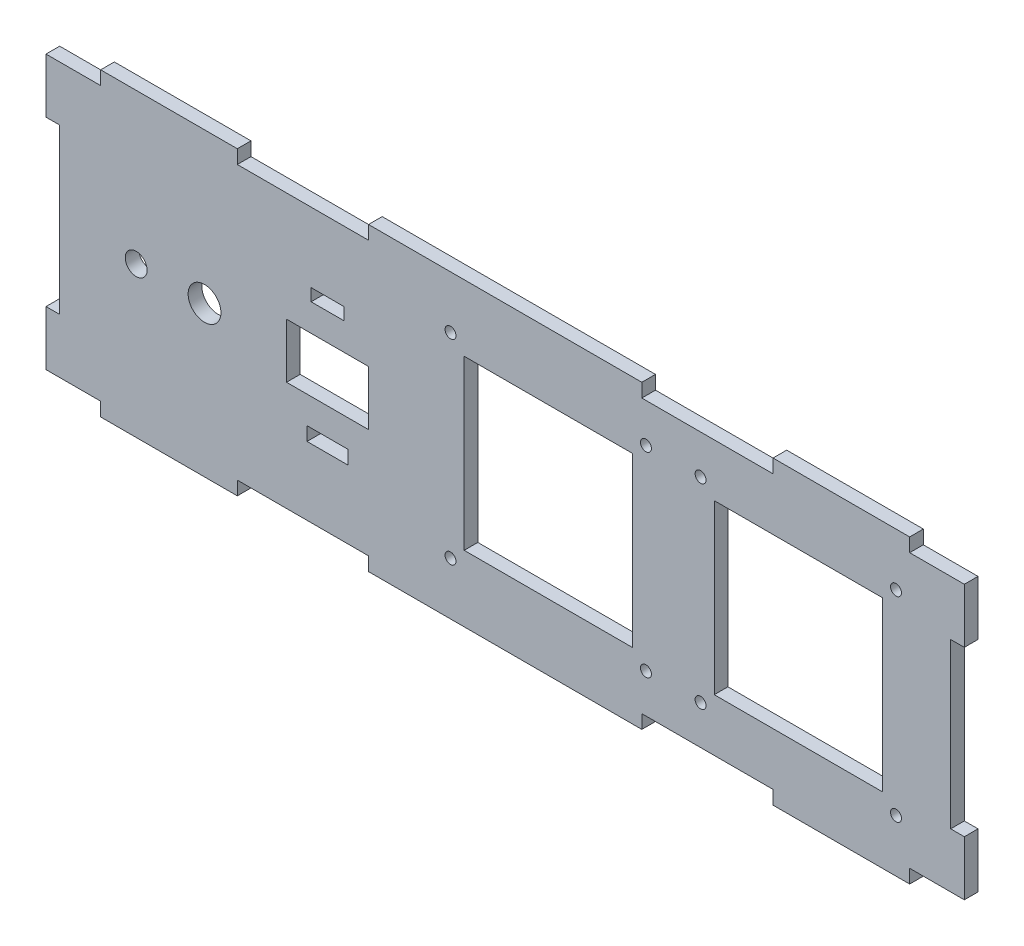
from build123d import *

# Parameters (mm, degrees)
SKETCH1_R           = 2
SKETCH1_W           = 15
SKETCH1_H           = 5
SKETCH1_W_2         = 61.5
SKETCH1_H_2         = 61.5
SKETCH1_R_2         = 4
SKETCH1_R_3         = 6
SKETCH1_W_3         = 30
SKETCH1_H_3         = 20
SKETCH1_W_4         = 12
SKETCH1_H_4         = 4.5
BOSS_EXTRUDE1_DEPTH = 5


with BuildPart() as part:
    # Sketch1 → Boss-Extrude1 (new body)
    with BuildSketch(Plane.XY):
        Polygon((148, -50), (168, -50), (168, -30), (163, -30), (163, 30), (168, 30), (168, 50), (148, 50), (148, 55), (98, 55), (98, 50), (50, 50), (50, 55), (-50, 55), (-50, 50), (-98, 50), (-98, 55), (-148, 55), (-148, 50), (-168, 50), (-168, 30), (-163, 30), (-163, -30), (-168, -30), (-168, -50), (-148, -50), (-148, -55), (-98, -55), (-98, -50), (-50, -50), (-50, -55), (50, -55), (50, -50), (98, -50), (98, -55), (148, -55), align=None)
        with Locations((-20, -35.75)):
            Circle(SKETCH1_R, mode=Mode.SUBTRACT)
        with Locations((-65, -22.5)):
            Rectangle(SKETCH1_W, SKETCH1_H, mode=Mode.SUBTRACT)
        with Locations((51.5, -35.75)):
            Circle(SKETCH1_R, mode=Mode.SUBTRACT)
        with Locations((71.5, -35.75)):
            Circle(SKETCH1_R, mode=Mode.SUBTRACT)
        with Locations((143, -35.75)):
            Circle(SKETCH1_R, mode=Mode.SUBTRACT)
        with Locations((15.75, 0)):
            Rectangle(SKETCH1_W_2, SKETCH1_H_2, mode=Mode.SUBTRACT)
        with Locations((-135, 0)):
            Circle(SKETCH1_R_2, mode=Mode.SUBTRACT)
        with Locations((-110, 0)):
            Circle(SKETCH1_R_3, mode=Mode.SUBTRACT)
        with Locations((-65, 0)):
            Rectangle(SKETCH1_W_3, SKETCH1_H_3, mode=Mode.SUBTRACT)
        with Locations((-65, 22.25)):
            Rectangle(SKETCH1_W_4, SKETCH1_H_4, mode=Mode.SUBTRACT)
        with Locations((-20, 35.75)):
            Circle(SKETCH1_R, mode=Mode.SUBTRACT)
        with Locations((107.25, 0)):
            Rectangle(SKETCH1_W_2, SKETCH1_H_2, mode=Mode.SUBTRACT)
        with Locations((51.5, 35.75)):
            Circle(SKETCH1_R, mode=Mode.SUBTRACT)
        with Locations((71.5, 35.75)):
            Circle(SKETCH1_R, mode=Mode.SUBTRACT)
        with Locations((143, 35.75)):
            Circle(SKETCH1_R, mode=Mode.SUBTRACT)
    extrude(amount=BOSS_EXTRUDE1_DEPTH)


solid = part.part
